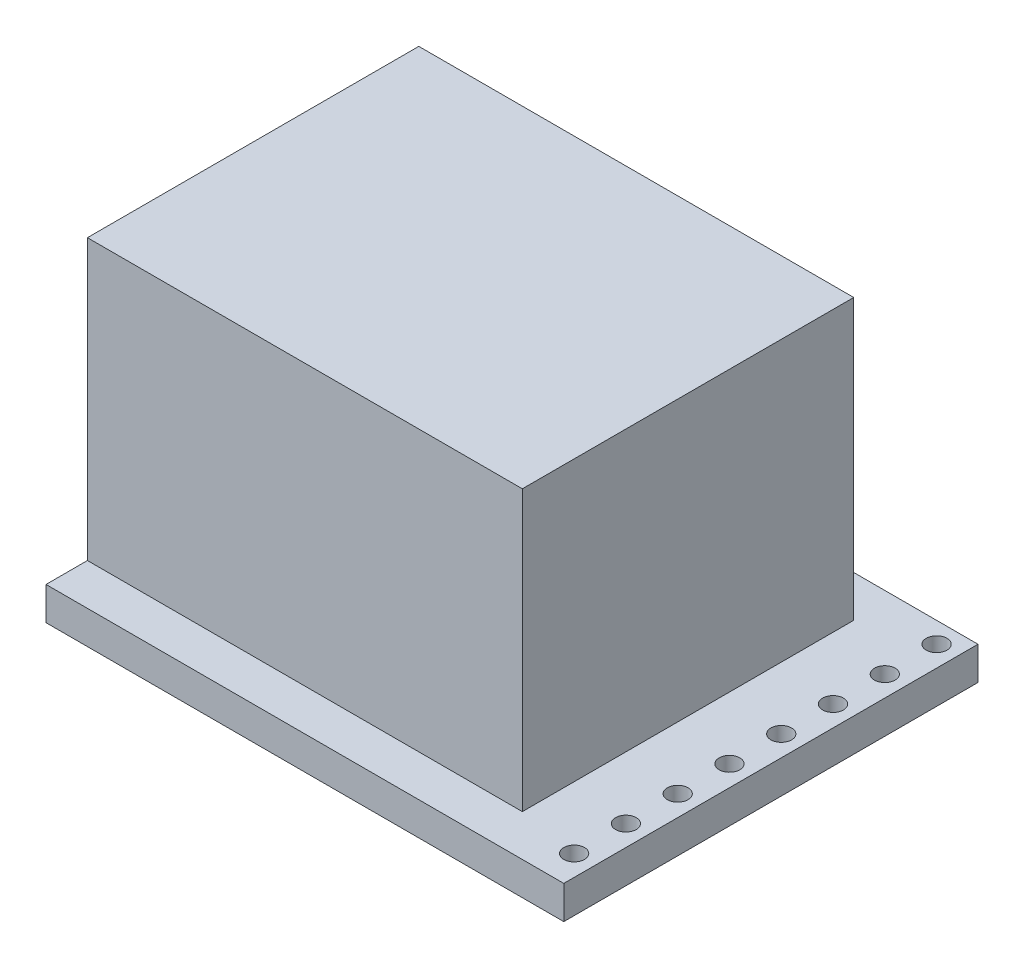
from build123d import *

# Parameters (mm, degrees)
SKETCH1_W           = 25
SKETCH1_H           = 20
BOSS_EXTRUDE1_DEPTH = 1.6
SKETCH2_W           = 21
SKETCH2_H           = 16
BOSS_EXTRUDE2_DEPTH = 13.5
CUT_EXTRUDE1_DEPTH  = 13.5
SKETCH4_R           = 0.5
CUT_EXTRUDE2_DEPTH  = 13.5
BOSS_EXTRUDE3_DEPTH = 2
SKETCH6_R           = 1.5
BOSS_EXTRUDE4_DEPTH = 2


with BuildPart() as part:
    # Sketch1 → Boss-Extrude1 (new body)
    with BuildSketch(Plane(origin=(0, 0, 0), x_dir=(1, 0, 0), z_dir=(0, 1, 0))):
        Rectangle(SKETCH1_W, SKETCH1_H)
    extrude(amount=-BOSS_EXTRUDE1_DEPTH)

    # Sketch2 → Boss-Extrude2 (add)
    with BuildSketch(Plane(origin=(0, 0, 0), x_dir=(1, 0, 0), z_dir=(0, 1, 0))):
        with Locations((-2, 0)):
            Rectangle(SKETCH2_W, SKETCH2_H)
    extrude(amount=BOSS_EXTRUDE2_DEPTH)

    # Sketch3 → Cut-Extrude1 (cut)
    with BuildSketch(Plane.ZY.offset(12.5)):
        Polygon((-6.2, 3.75), (-3.5, 3.75), (-3.5, 2.25), (3.5, 2.25), (3.5, 3.75), (6.2, 3.75), (6.2, 10.75), (-6.2, 10.75), align=None)
    extrude(amount=-CUT_EXTRUDE1_DEPTH, mode=Mode.SUBTRACT)

    # Sketch4 → Cut-Extrude2 (cut)
    with BuildSketch(Plane(origin=(0, 0, 0), x_dir=(1, 0, 0), z_dir=(0, 1, 0))):
        with Locations(Location((11.5, 9, 0), (0, 0, 270))):
            Circle(SKETCH4_R)
        with Locations(Location((11.5, 6.5, 0), (0, 0, 270))):
            Circle(SKETCH4_R)
        with Locations(Location((11.5, 4, 0), (0, 0, 270))):
            Circle(SKETCH4_R)
        with Locations(Location((11.5, 1.5, 0), (0, 0, 270))):
            Circle(SKETCH4_R)
        with Locations(Location((11.5, -1, 0), (0, 0, 270))):
            Circle(SKETCH4_R)
        with Locations(Location((11.5, -3.5, 0), (0, 0, 270))):
            Circle(SKETCH4_R)
        with Locations(Location((11.5, -6, 0), (0, 0, 270))):
            Circle(SKETCH4_R)
        with Locations(Location((11.5, -8.5, 0), (0, 0, 270))):
            Circle(SKETCH4_R)
    extrude(amount=-CUT_EXTRUDE2_DEPTH, mode=Mode.SUBTRACT)

    # Sketch5 → Boss-Extrude3 (add)
    with BuildSketch(Plane(origin=(0, -1.6, 0), x_dir=(-1, 0, 0), z_dir=(0, -1, 0))):
        with BuildLine():
            Line((-8.5, -4), (-8.5, 4))
            ThreePointArc((-8.5, 4), (-6.5, 6), (-4.5, 4))
            Line((-4.5, 4), (-4.5, -4))
            ThreePointArc((-4.5, -4), (-6.5, -6), (-8.5, -4))
        make_face()
    extrude(amount=BOSS_EXTRUDE3_DEPTH)

    # Sketch6 → Boss-Extrude4 (add)
    with BuildSketch(Plane.XZ.offset(1.6)):
        with Locations(Location((-2.5, 6, 0), (0, 0, 270))):
            Circle(SKETCH6_R)
        with Locations(Location((-2.5, -6, 0), (0, 0, 270))):
            Circle(SKETCH6_R)
    extrude(amount=BOSS_EXTRUDE4_DEPTH)


solid = part.part
